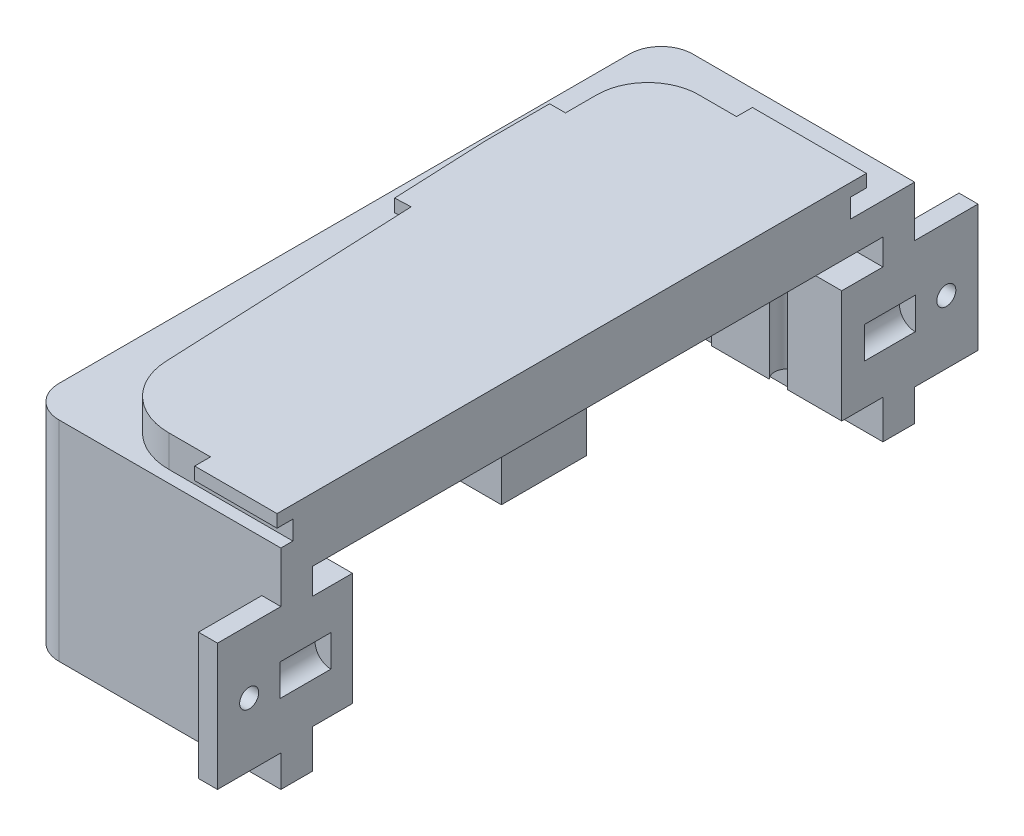
from build123d import *

# Parameters (mm, degrees)
SKETCH8_R                        = 10
BOSS_EXTRUDE6_DEPTH              = 5
BOSS_EXTRUDE7_START              = 5
BOSS_EXTRUDE7_DEPTH              = 5
EXTRUDE_THIN4_DEPTH              = 8
EXTRUDE_THIN4_DEPTH_BACK         = 20
SKETCH2_W                        = 70
SKETCH2_H                        = 90
BOSS_EXTRUDE8_DEPTH              = 5
BOSS_EXTRUDE9_DEPTH              = 5
BOSS_EXTRUDE10_REACH             = 81.849
SKETCH13_W                       = 6.5
SKETCH13_H                       = 17.8
SKETCH13_W_2                     = 6.3
BOSS_EXTRUDE10_DIRECTION_2_REACH = 81.849
SKETCH15_R                       = 2
CUT_EXTRUDE1_DEPTH               = 17.8
SKETCH17_W                       = 36
SKETCH17_H                       = 3
SKETCH17_W_2                     = 26
BOSS_EXTRUDE11_DEPTH             = 2
SKETCH18_W                       = 36
SKETCH18_H                       = 3
SKETCH18_W_2                     = 26
BOSS_EXTRUDE12_DEPTH             = 2
BOSS_EXTRUDE13_DEPTH             = 3
BOSS_EXTRUDE13_DEPTH_BACK        = 3
SKETCH19_W                       = 10
SKETCH19_H                       = 20
SKETCH19_R                       = 1.5
SKETCH21_R                       = 2.5
CUT_EXTRUDE5_DEPTH               = 8
SKETCH23_R                       = 2.5
CUT_EXTRUDE6_DEPTH               = 8
SKETCH24_W                       = 150
SKETCH24_H                       = 150
CUT_EXTRUDE7_DEPTH               = 85.574286873
SKETCH25_W                       = 150
SKETCH25_H                       = 150
CUT_EXTRUDE8_DEPTH               = 87.935665869
SKETCH26_W                       = 6.3
SKETCH26_H                       = 6.3
SKETCH26_W_2                     = 6.5
SKETCH26_H_2                     = 6.5
BOSS_EXTRUDE14_DEPTH             = 6.1
SKETCH27_R                       = 2
CUT_EXTRUDE9_DEPTH               = 8
SKETCH28_W                       = 15
SKETCH28_H                       = 13.4
BOSS_EXTRUDE15_DEPTH             = 15
CUT_EXTRUDE10_DEPTH              = 87.935665869
CUT_EXTRUDE10_DEPTH_BACK         = 87.935665869
SKETCH29_R                       = 5


with BuildPart() as part:
    # Sketch8 → Boss-Extrude6 (new body)
    with BuildSketch(Plane(origin=(0, 0, 0), x_dir=(-1, 0, 0), z_dir=(0, 1, 0))):
        with BuildLine():
            Line((32, -36), (32, -21))
            Line((32, -21), (29.579603504, 34.436193874))
            ThreePointArc((29.579603504, 34.436193874), (26.504251846, 41.223639621), (19.589121288, 44))
            Line((19.589121288, 44), (-19.589121288, 44))
            ThreePointArc((-19.589121288, 44), (-26.504251846, 41.223639621), (-29.579603504, 34.436193874))
            Line((-29.579603504, 34.436193874), (-32, -21))
            Line((-32, -21), (-32, -36))
            ThreePointArc((-32, -36), (-29.656854249, -41.656854249), (-24, -44))
            Line((-24, -44), (24, -44))
            ThreePointArc((24, -44), (29.656854249, -41.656854249), (32, -36))
        make_face()
        with Locations(Location((15.9, 11.8, 0), (0, 0, 90))):
            Circle(SKETCH8_R, mode=Mode.SUBTRACT)
        with Locations(Location((-15.9, 11.8, 0), (0, 0, 90))):
            Circle(SKETCH8_R, mode=Mode.SUBTRACT)
        with Locations(Location((15.9, -20, 0), (0, 0, 90))):
            Circle(SKETCH8_R, mode=Mode.SUBTRACT)
        with Locations(Location((-15.9, -20, 0), (0, 0, 90))):
            Circle(SKETCH8_R, mode=Mode.SUBTRACT)
    extrude(amount=-BOSS_EXTRUDE6_DEPTH)

    # Sketch1 → Boss-Extrude7 (add)
    # profile 1 of 2: a face of its own
    with BuildSketch(Plane(origin=(0, 0, 0), x_dir=(1, 0, 0), z_dir=(0, 1, 0)).offset(BOSS_EXTRUDE7_START)):
        with BuildLine():
            Line((-35, 54.1), (35, 54.1))
            ThreePointArc((35, 54.1), (38.535533906, 52.635533906), (40, 49.1))
            Line((40, 49.1), (40, -40.9))
            ThreePointArc((40, -40.9), (38.535533906, -44.435533906), (35, -45.9))
            Line((35, -45.9), (-35, -45.9))
            ThreePointArc((-35, -45.9), (-38.535533906, -44.435533906), (-40, -40.9))
            Line((-40, -40.9), (-40, 49.1))
            ThreePointArc((-40, 49.1), (-38.535533906, 52.635533906), (-35, 54.1))
        make_face()
        with BuildLine():
            ThreePointArc((32, 36), (29.656854249, 41.656854249), (24, 44))
            Line((24, 44), (-24, 44))
            ThreePointArc((-24, 44), (-29.656854249, 41.656854249), (-32, 36))
            Line((-32, 36), (-32, 21))
            Line((-32, 21), (-29.579603504, -34.436193874))
            ThreePointArc((-29.579603504, -34.436193874), (-26.504251846, -41.223639621), (-19.589121288, -44))
            Line((-19.589121288, -44), (19.589121288, -44))
            ThreePointArc((19.589121288, -44), (26.504251846, -41.223639621), (29.579603504, -34.436193874))
            Line((29.579603504, -34.436193874), (32, 21))
            Line((32, 21), (32, 36))
        make_face(mode=Mode.SUBTRACT)
    # profile 2 of 2: a face of its own
    with BuildSketch(Plane(origin=(0, 0, 0), x_dir=(1, 0, 0), z_dir=(0, 1, 0)).offset(BOSS_EXTRUDE7_START)):
        with BuildLine():
            Line((32, 36), (32, 21))
            Line((32, 21), (29.579603504, -34.436193874))
            ThreePointArc((29.579603504, -34.436193874), (26.504251846, -41.223639621), (19.589121288, -44))
            Line((19.589121288, -44), (-19.589121288, -44))
            ThreePointArc((-19.589121288, -44), (-26.504251846, -41.223639621), (-29.579603504, -34.436193874))
            Line((-29.579603504, -34.436193874), (-32, 21))
            Line((-32, 21), (-32, 36))
            ThreePointArc((-32, 36), (-29.656854249, 41.656854249), (-24, 44))
            Line((-24, 44), (24, 44))
            ThreePointArc((24, 44), (29.656854249, 41.656854249), (32, 36))
        make_face()
        with BuildLine():
            ThreePointArc((-24, 41), (-27.535533906, 39.535533906), (-29, 36))
            Line((-29, 36), (-29, 21.065460233))
            Line((-29, 21.065460233), (-26.582458839, -34.305335712))
            ThreePointArc((-26.582458839, -34.305335712), (-24.429712679, -39.056547734), (-19.589121288, -41))
            Line((-19.589121288, -41), (19.589121288, -41))
            ThreePointArc((19.589121288, -41), (24.429712679, -39.056547734), (26.582458839, -34.305335712))
            Line((26.582458839, -34.305335712), (29, 21.065460233))
            Line((29, 21.065460233), (29, 36))
            ThreePointArc((29, 36), (27.535533906, 39.535533906), (24, 41))
            Line((24, 41), (-24, 41))
        make_face(mode=Mode.SUBTRACT)
    extrude(amount=-BOSS_EXTRUDE7_DEPTH)

    # Sketch17 → Boss-Extrude11 (add)
    with BuildSketch(Plane(origin=(0, -5, 0), x_dir=(1, 0, 0), z_dir=(0, 1, 0))):
        with Locations((0, 45)):
            Rectangle(SKETCH17_W, SKETCH17_H)
        with Locations((0, -45)):
            Rectangle(SKETCH17_W_2, SKETCH17_H)
        Polygon((-31.5, 21.010910039), (-30.84570919, 6.025186715), (-33.842853854, 5.894328553), (-34.5, 20.945449806), (-34.5, 31.010910039), (-31.5, 31.010910039), align=None)
        Polygon((31.5, 21.010910039), (31.5, 31.010910039), (34.5, 31.010910039), (34.5, 20.945449806), (33.842853854, 5.894328553), (30.84570919, 6.025186715), align=None)
    extrude(amount=BOSS_EXTRUDE11_DEPTH)

    # Sketch24 → Cut-Extrude7 (cut, through all)
    with BuildSketch(Plane(origin=(0, 5, 0), x_dir=(1, 0, 0), z_dir=(0, 1, 0))):
        Rectangle(SKETCH24_W, SKETCH24_H)
    extrude(amount=-CUT_EXTRUDE7_DEPTH, mode=Mode.SUBTRACT)


with BuildPart() as body_2:
    # Sketch2 → Extrude-Thin4 (new, two sides: drawn at the far end of the back side and taken through both)
    with BuildSketch(Plane(origin=(0, 25, 0), x_dir=(1, 0, 0), z_dir=(0, 1, 0)).offset(-EXTRUDE_THIN4_DEPTH_BACK)):
        with BuildLine():
            Line((-40, 49.1), (-40, -40.9))
            ThreePointArc((-40, -40.9), (-38.535533906, -44.435533906), (-35, -45.9))
            Line((-35, -45.9), (35, -45.9))
            ThreePointArc((35, -45.9), (38.535533906, -44.435533906), (40, -40.9))
            Line((40, -40.9), (40, 49.1))
            ThreePointArc((40, 49.1), (38.535533906, 52.635533906), (35, 54.1))
            Line((35, 54.1), (-35, 54.1))
            ThreePointArc((-35, 54.1), (-38.535533906, 52.635533906), (-40, 49.1))
        make_face()
        with Locations((0, 4.1)):
            Rectangle(SKETCH2_W, SKETCH2_H, mode=Mode.SUBTRACT)
    extrude(amount=EXTRUDE_THIN4_DEPTH + EXTRUDE_THIN4_DEPTH_BACK)

    # Sketch13 → Boss-Extrude10 (add, up to next)
    with BuildSketch(Plane(origin=(0, 0, 0), x_dir=(0, 0, -1), z_dir=(1, 0, 0)), mode=Mode.PRIVATE) as boss_extrude10_sk1:
        with Locations((45.85, 20)):
            Rectangle(SKETCH13_W, SKETCH13_H)
    boss_extrude10_tool1 = extrude(boss_extrude10_sk1.sketch, amount=BOSS_EXTRUDE10_REACH, mode=Mode.PRIVATE) - body_2.part
    # Sketch13 → Boss-Extrude10 (add, up to next)
    with BuildSketch(Plane(origin=(0, 0, 0), x_dir=(0, 0, -1), z_dir=(1, 0, 0)), mode=Mode.PRIVATE) as boss_extrude10_sk2:
        with Locations((-37.75, 20)):
            Rectangle(SKETCH13_W_2, SKETCH13_H)
    boss_extrude10_tool2 = extrude(boss_extrude10_sk2.sketch, amount=BOSS_EXTRUDE10_REACH, mode=Mode.PRIVATE) - body_2.part
    add(boss_extrude10_tool1.solids().sort_by_distance((0, 20, -45.85))[0])
    add(boss_extrude10_tool2.solids().sort_by_distance((0, 20, 37.75))[0])

    # Sketch13 → Boss-Extrude10 direction 2 (add, up to next)
    with BuildSketch(Plane(origin=(0, 0, 0), x_dir=(0, 0, -1), z_dir=(1, 0, 0)), mode=Mode.PRIVATE) as boss_extrude10_direction_2_sk1:
        with Locations((45.85, 20)):
            Rectangle(SKETCH13_W, SKETCH13_H)
    boss_extrude10_direction_2_tool1 = extrude(boss_extrude10_direction_2_sk1.sketch, amount=-BOSS_EXTRUDE10_DIRECTION_2_REACH, mode=Mode.PRIVATE) - body_2.part
    # Sketch13 → Boss-Extrude10 direction 2 (add, up to next)
    with BuildSketch(Plane(origin=(0, 0, 0), x_dir=(0, 0, -1), z_dir=(1, 0, 0)), mode=Mode.PRIVATE) as boss_extrude10_direction_2_sk2:
        with Locations((-37.75, 20)):
            Rectangle(SKETCH13_W_2, SKETCH13_H)
    boss_extrude10_direction_2_tool2 = extrude(boss_extrude10_direction_2_sk2.sketch, amount=-BOSS_EXTRUDE10_DIRECTION_2_REACH, mode=Mode.PRIVATE) - body_2.part
    add(boss_extrude10_direction_2_tool1.solids().sort_by_distance((0, 20, -45.85))[0])
    add(boss_extrude10_direction_2_tool2.solids().sort_by_distance((0, 20, 37.75))[0])

    # Sketch15 → Cut-Extrude1 (cut)
    with BuildSketch(Plane.XZ.offset(-11.1)):
        with Locations((-22, -44)):
            Circle(SKETCH15_R)
        with Locations((-10, -44)):
            Circle(SKETCH15_R)
        with Locations((-22, 36)):
            Circle(SKETCH15_R)
        with Locations((-10, 36)):
            Circle(SKETCH15_R)
        with Locations((10, 36)):
            Circle(SKETCH15_R)
        with Locations((22, 36)):
            Circle(SKETCH15_R)
        with Locations((10, -44)):
            Circle(SKETCH15_R)
        with Locations((22, -44)):
            Circle(SKETCH15_R)
    extrude(amount=-CUT_EXTRUDE1_DEPTH, mode=Mode.SUBTRACT)

    # Sketch19 → Boss-Extrude13 (add, two sides: drawn at the far end of the back side and taken through both)
    # profile 1 of 2: a face of its own
    with BuildSketch(Plane(origin=(0, 0, 0), x_dir=(0, 0, -1), z_dir=(1, 0, 0)).offset(-BOSS_EXTRUDE13_DEPTH_BACK)):
        with Locations((-50.9, 20)):
            Rectangle(SKETCH19_W, SKETCH19_H)
        with Locations((-50.9, 20)):
            Circle(SKETCH19_R, mode=Mode.SUBTRACT)
    # profile 2 of 2: a face of its own
    with BuildSketch(Plane(origin=(0, 0, 0), x_dir=(0, 0, -1), z_dir=(1, 0, 0)).offset(-BOSS_EXTRUDE13_DEPTH_BACK)):
        with Locations((59.1, 20)):
            Rectangle(SKETCH19_W, SKETCH19_H)
        with Locations((59.1, 20)):
            Circle(SKETCH19_R, mode=Mode.SUBTRACT)
    extrude(amount=BOSS_EXTRUDE13_DEPTH + BOSS_EXTRUDE13_DEPTH_BACK)

    # Sketch21 → Cut-Extrude5 (cut)
    with BuildSketch(Plane.XY.offset(38)):
        with Locations((0, 20)):
            Circle(SKETCH21_R)
    extrude(amount=CUT_EXTRUDE5_DEPTH, mode=Mode.SUBTRACT)

    # Sketch23 → Cut-Extrude6 (cut)
    with BuildSketch(Plane.XY.offset(-46.2)):
        with Locations((0, 20)):
            Circle(SKETCH23_R)
    extrude(amount=-CUT_EXTRUDE6_DEPTH, mode=Mode.SUBTRACT)


with BuildPart() as body_3:
    # Sketch10 → Boss-Extrude8 (new body)
    with BuildSketch(Plane(origin=(0, 38, 0), x_dir=(1, 0, 0), z_dir=(0, 1, 0))):
        with BuildLine():
            Line((-32, 36), (-32, 21))
            Line((-32, 21), (-29.579603504, -34.436193874))
            ThreePointArc((-29.579603504, -34.436193874), (-26.504251846, -41.223639621), (-19.589121288, -44))
            Line((-19.589121288, -44), (19.589121288, -44))
            ThreePointArc((19.589121288, -44), (26.504251846, -41.223639621), (29.579603504, -34.436193874))
            Line((29.579603504, -34.436193874), (32, 21))
            Line((32, 21), (32, 36))
            ThreePointArc((32, 36), (29.656854249, 41.656854249), (24, 44))
            Line((24, 44), (-24, 44))
            ThreePointArc((-24, 44), (-29.656854249, 41.656854249), (-32, 36))
        make_face()
    extrude(amount=BOSS_EXTRUDE8_DEPTH)

    # Sketch11 → Boss-Extrude9 (add)
    with BuildSketch(Plane(origin=(0, 38, 0), x_dir=(1, 0, 0), z_dir=(0, 1, 0))):
        with BuildLine():
            Line((-35, -45.9), (35, -45.9))
            ThreePointArc((35, -45.9), (38.535533906, -44.435533906), (40, -40.9))
            Line((40, -40.9), (40, 49.1))
            ThreePointArc((40, 49.1), (38.535533906, 52.635533906), (35, 54.1))
            Line((35, 54.1), (-35, 54.1))
            ThreePointArc((-35, 54.1), (-38.535533906, 52.635533906), (-40, 49.1))
            Line((-40, 49.1), (-40, -40.9))
            ThreePointArc((-40, -40.9), (-38.535533906, -44.435533906), (-35, -45.9))
        make_face()
    extrude(amount=-BOSS_EXTRUDE9_DEPTH)

    # Sketch18 → Boss-Extrude12 (add)
    with BuildSketch(Plane(origin=(0, 43, 0), x_dir=(1, 0, 0), z_dir=(0, 1, 0))):
        with Locations((0, 45)):
            Rectangle(SKETCH18_W, SKETCH18_H)
        with Locations((0, -45)):
            Rectangle(SKETCH18_W_2, SKETCH18_H)
        Polygon((-31.5, 21.010910039), (-30.84570919, 6.025186715), (-33.842853854, 5.894328553), (-34.5, 20.945449806), (-34.5, 31.010910039), (-31.5, 31.010910039), align=None)
        Polygon((31.5, 21.010910039), (31.5, 31.010910039), (34.5, 31.010910039), (34.5, 20.945449806), (33.842853854, 5.894328553), (30.84570919, 6.025186715), align=None)
    extrude(amount=-BOSS_EXTRUDE12_DEPTH)


with BuildPart() as cut_extrude8_tool:
    # Sketch25 → Cut-Extrude8 (new, through all)
    with BuildSketch(Plane(origin=(0, 0, 0), x_dir=(0, 0, -1), z_dir=(1, 0, 0))):
        Rectangle(SKETCH25_W, SKETCH25_H)
    extrude(amount=CUT_EXTRUDE8_DEPTH)


with BuildPart() as body_2_1:
    add(body_2.part)

    # Cut-Extrude8: cut by cut_extrude8_tool
    add(cut_extrude8_tool.part, mode=Mode.SUBTRACT)

    # Sketch26 → Boss-Extrude14 (add)
    with BuildSketch(Plane.XZ.offset(-11.1)):
        with Locations((-31.85, 37.75)):
            Rectangle(SKETCH26_W, SKETCH26_H)
        with Locations((-31.75, -45.85)):
            Rectangle(SKETCH26_W_2, SKETCH26_H_2)
    extrude(amount=BOSS_EXTRUDE14_DEPTH)

    # Sketch27 → Cut-Extrude9 (cut)
    with BuildSketch(Plane.XZ.offset(-5)):
        with Locations(Location((-35, 40.9, 0), (0, 0, 270))):
            Circle(SKETCH27_R)
        with Locations(Location((-35, -49.1, 0), (0, 0, 270))):
            Circle(SKETCH27_R)
    extrude(amount=-CUT_EXTRUDE9_DEPTH, mode=Mode.SUBTRACT)


with BuildPart() as body_3_1:
    add(body_3.part)

    # Cut-Extrude8: cut by cut_extrude8_tool
    add(cut_extrude8_tool.part, mode=Mode.SUBTRACT)


    add(body_2_1.part)  # Boss-Extrude15 merges body 2
    # Sketch28 → Boss-Extrude15 (add)
    with BuildSketch(Plane.XZ.offset(-33)):
        with Locations((-16, -4.1)):
            Rectangle(SKETCH28_W, SKETCH28_H)
    extrude(amount=BOSS_EXTRUDE15_DEPTH)

    # Sketch29 → Cut-Extrude10 (cut, two sides: drawn at the far end of the back side and taken through both)
    with BuildSketch(Plane(origin=(0, 0, 0), x_dir=(0, 0, -1), z_dir=(1, 0, 0)).offset(-CUT_EXTRUDE10_DEPTH_BACK)):
        with Locations((-21, 12)):
            Circle(SKETCH29_R)
        with Locations((29, 12)):
            Circle(SKETCH29_R)
    extrude(amount=CUT_EXTRUDE10_DEPTH + CUT_EXTRUDE10_DEPTH_BACK, mode=Mode.SUBTRACT)


solid = body_3_1.part
